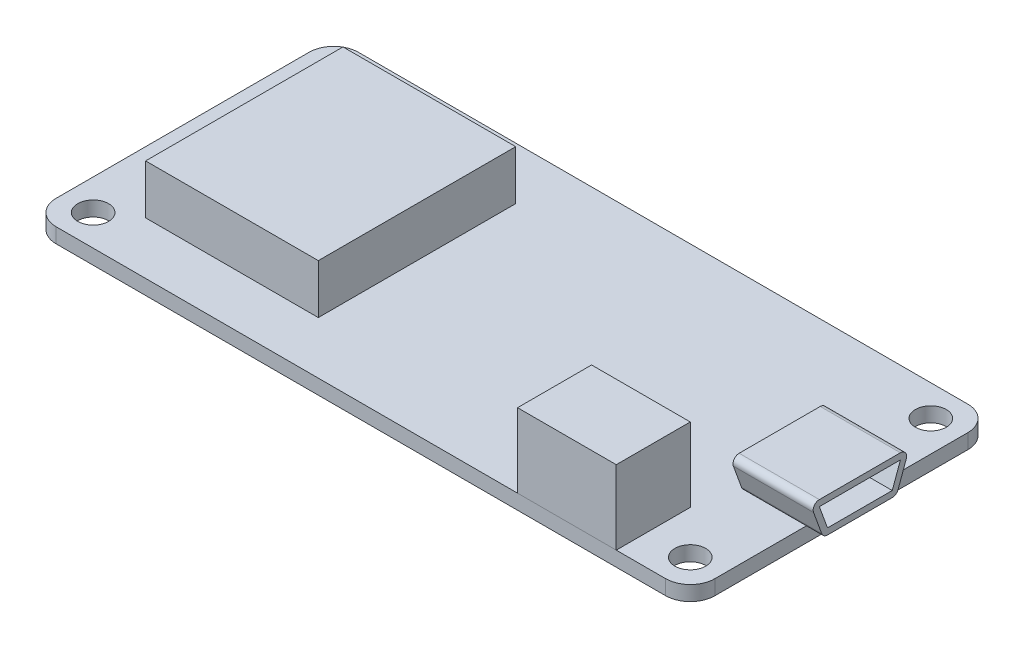
from build123d import *

# Parameters (mm, degrees)
SKETCH1_R                = 1.25
BOSS_EXTRUDE1_DEPTH      = 1.2
BOSS_EXTRUDE2_DEPTH      = 1.5
BOSS_EXTRUDE2_DEPTH_BACK = 5
SKETCH3_W                = 14
SKETCH3_H                = 16
BOSS_EXTRUDE3_DEPTH      = 4
SKETCH4_W                = 8
SKETCH4_H                = 6
BOSS_EXTRUDE4_DEPTH      = 6


with BuildPart() as part:
    # Sketch1 → Boss-Extrude1 (new body)
    with BuildSketch(Plane(origin=(0, 0, 0), x_dir=(1, 0, 0), z_dir=(0, 1, 0))):
        with BuildLine():
            Line((2, 0), (51.4, 0))
            ThreePointArc((51.4, 0), (52.814213562, 0.585786438), (53.4, 2))
            Line((53.4, 2), (53.4, 22.5))
            ThreePointArc((53.4, 22.5), (52.814213562, 23.914213562), (51.4, 24.5))
            Line((51.4, 24.5), (2, 24.5))
            ThreePointArc((2, 24.5), (0.585786438, 23.914213562), (0, 22.5))
            Line((0, 22.5), (0, 2))
            ThreePointArc((0, 2), (0.585786438, 0.585786438), (2, 0))
        make_face()
        with Locations(Location((2.5, 22, 0), (0, 0, 270))):
            Circle(SKETCH1_R, mode=Mode.SUBTRACT)
        with Locations(Location((50.9, 22, 0), (0, 0, 270))):
            Circle(SKETCH1_R, mode=Mode.SUBTRACT)
        with Locations(Location((50.9, 2.5, 0), (0, 0, 270))):
            Circle(SKETCH1_R, mode=Mode.SUBTRACT)
        with Locations(Location((2.5, 2.5, 0), (0, 0, 270))):
            Circle(SKETCH1_R, mode=Mode.SUBTRACT)
    extrude(amount=BOSS_EXTRUDE1_DEPTH)


with BuildPart() as body_2:
    # Sketch2 → Boss-Extrude2 (new, two sides: drawn at the far end of the back side and taken through both)
    with BuildSketch(Plane(origin=(53.4, 0, 0), x_dir=(0, 0, -1), z_dir=(1, 0, 0)).offset(-BOSS_EXTRUDE2_DEPTH_BACK)):
        with BuildLine():
            Line((8.964074003, 4.019077862), (15.535925997, 4.019077862))
            ThreePointArc((15.535925997, 4.019077862), (15.945502019, 3.805866081), (16.005772307, 3.348067791))
            Line((16.005772307, 3.348067791), (15.343682111, 1.528989928))
            ThreePointArc((15.343682111, 1.528989928), (15.160624019, 1.290423978), (14.873835801, 1.2))
            Line((14.873835801, 1.2), (9.626164199, 1.2))
            ThreePointArc((9.626164199, 1.2), (9.339375981, 1.290423978), (9.156317889, 1.528989928))
            Line((9.156317889, 1.528989928), (8.494227693, 3.348067791))
            ThreePointArc((8.494227693, 3.348067791), (8.554497981, 3.805866081), (8.964074003, 4.019077862))
        make_face()
        Polygon((8.964074003, 3.519077862), (9.626164199, 1.7), (14.873835801, 1.7), (15.535925997, 3.519077862), align=None, mode=Mode.SUBTRACT)
    extrude(amount=BOSS_EXTRUDE2_DEPTH + BOSS_EXTRUDE2_DEPTH_BACK)


with BuildPart() as body_3:
    # Sketch3 → Boss-Extrude3 (new body)
    with BuildSketch(Plane(origin=(0, 1.2, 0), x_dir=(1, 0, 0), z_dir=(0, 1, 0))):
        with Locations((12, 12.25)):
            Rectangle(SKETCH3_W, SKETCH3_H)
    extrude(amount=BOSS_EXTRUDE3_DEPTH)


with BuildPart() as body_4:
    # Sketch4 → Boss-Extrude4 (new body)
    with BuildSketch(Plane(origin=(0, 1.2, 0), x_dir=(1, 0, 0), z_dir=(0, 1, 0))):
        with Locations((43.4, 3)):
            Rectangle(SKETCH4_W, SKETCH4_H)
    extrude(amount=BOSS_EXTRUDE4_DEPTH)


solid = Compound([part.part, body_2.part, body_3.part, body_4.part])
